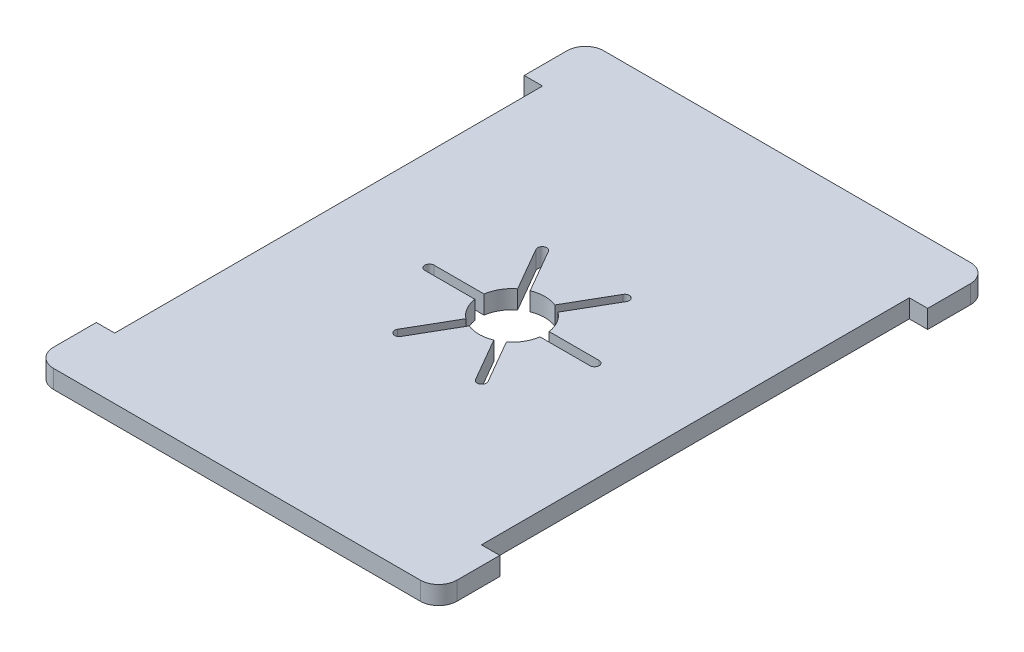
from build123d import *

# Parameters (mm, degrees)
BOSS_EXTRUDE1_DEPTH = 3
SKETCH2_R           = 2.69
CUT_EXTRUDE1_DEPTH  = 10
SKETCH3_R           = 5.375
CUT_EXTRUDE2_DEPTH  = 10


with BuildPart() as part:
    # Sketch1 → Boss-Extrude1 (new body)
    with BuildSketch(Plane(origin=(0, 0, 0), x_dir=(1, 0, 0), z_dir=(0, 1, 0))):
        with BuildLine():
            ThreePointArc((-33, -42), (-32.121320344, -44.121320344), (-30, -45))
            Line((-30, -45), (30, -45))
            ThreePointArc((30, -45), (32.121320344, -44.121320344), (33, -42))
            Line((33, -42), (33, -35))
            Line((33, -35), (30, -35))
            Line((30, -35), (30, 35))
            Line((30, 35), (33, 35))
            Line((33, 35), (33, 42))
            ThreePointArc((33, 42), (32.121320344, 44.121320344), (30, 45))
            Line((30, 45), (-30, 45))
            ThreePointArc((-30, 45), (-32.121320344, 44.121320344), (-33, 42))
            Line((-33, 42), (-33, 35))
            Line((-33, 35), (-30, 35))
            Line((-30, 35), (-30, -35))
            Line((-30, -35), (-33, -35))
            Line((-33, -35), (-33, -42))
        make_face()
    extrude(amount=BOSS_EXTRUDE1_DEPTH)

    # Sketch2 → Cut-Extrude1 (cut)
    with BuildSketch(Plane(origin=(0, 3, 0), x_dir=(1, 0, 0), z_dir=(0, 1, 0))):
        Circle(SKETCH2_R)
        with BuildLine():
            Line((-13.5, 0.75), (13.5, 0.75))
            ThreePointArc((13.5, 0.75), (14.25, 0), (13.5, -0.75))
            Line((13.5, -0.75), (-13.5, -0.75))
            ThreePointArc((-13.5, -0.75), (-14.25, 0), (-13.5, 0.75))
        make_face()
        with BuildLine():
            Line((-7.399519053, -11.316342951), (6.100480947, 12.066342951))
            ThreePointArc((6.100480947, 12.066342951), (7.125, 12.340862004), (7.399519053, 11.316342951))
            Line((7.399519053, 11.316342951), (-6.100480947, -12.066342951))
            ThreePointArc((-6.100480947, -12.066342951), (-7.125, -12.340862004), (-7.399519053, -11.316342951))
        make_face()
        with BuildLine():
            Line((6.100480947, -12.066342951), (-7.399519053, 11.316342951))
            ThreePointArc((-7.399519053, 11.316342951), (-7.125, 12.340862004), (-6.100480947, 12.066342951))
            Line((-6.100480947, 12.066342951), (7.399519053, -11.316342951))
            ThreePointArc((7.399519053, -11.316342951), (7.125, -12.340862004), (6.100480947, -12.066342951))
        make_face()
    extrude(amount=-CUT_EXTRUDE1_DEPTH, mode=Mode.SUBTRACT)

    # Sketch3 → Cut-Extrude2 (cut)
    with BuildSketch(Plane(origin=(0, 3, 0), x_dir=(1, 0, 0), z_dir=(0, 1, 0))):
        Circle(SKETCH3_R)
    extrude(amount=-CUT_EXTRUDE2_DEPTH, mode=Mode.SUBTRACT)


solid = part.part
